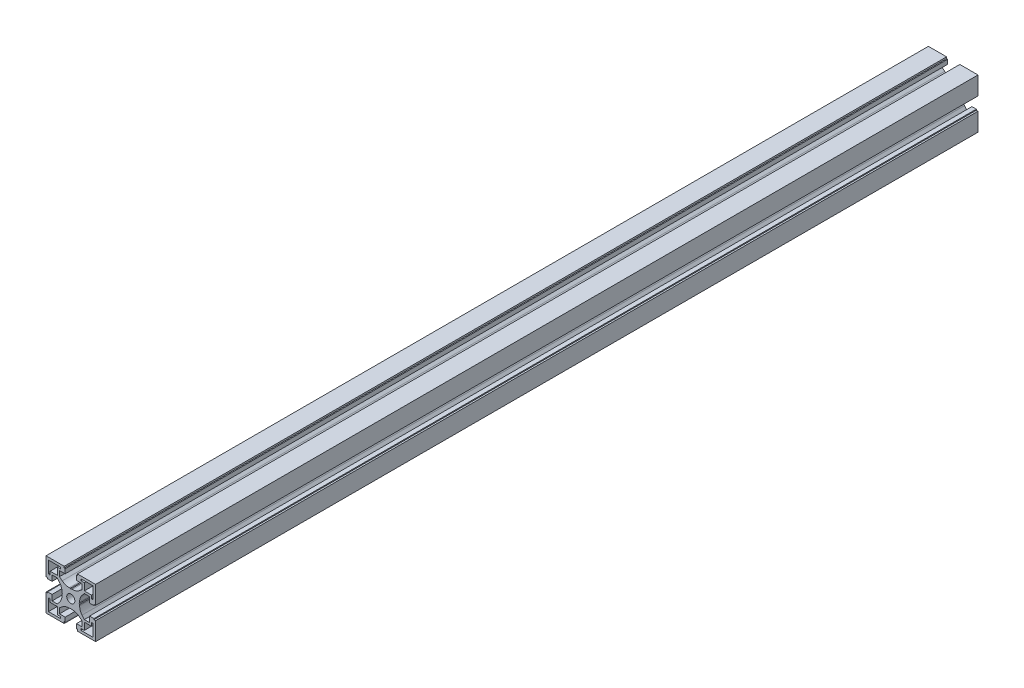
from build123d import *

# Parameters (mm, degrees)
MODEL_R             = 3.7
BOSS_EXTRUDE1_DEPTH = 800.5


with BuildPart() as part:
    # Model → Boss-Extrude1 (new body)
    with BuildSketch(Plane.XY):
        with BuildLine():
            Line((0.5, 8), (1.472732261, 8))
            ThreePointArc((1.472732261, 8), (4.799135414, 8.56946226), (7.746686356, 10.212991588))
            Line((7.746686356, 10.212991588), (10.25, 12.229898987))
            Line((10.25, 12.229898987), (10.25, 17))
            Line((10.25, 17), (5.1, 17))
            Line((5.1, 17), (5.1, 21))
            Line((5.1, 21), (5.999986755, 21))
            Line((5.999986755, 21), (5.999986755, 22.5))
            Line((5.999986755, 22.5), (22.5, 22.5))
            Line((22.5, 22.5), (22.5, 5.999986755))
            Line((22.5, 5.999986755), (21, 5.999986755))
            Line((21, 5.999986755), (21, 5.1))
            Line((21, 5.1), (17, 5.1))
            Line((17, 5.1), (17, 10.25))
            Line((17, 10.25), (12.229898987, 10.25))
            Line((12.229898987, 10.25), (10.212991588, 7.746686356))
            ThreePointArc((10.212991588, 7.746686356), (8.56946226, 4.799135414), (8, 1.472732261))
            Line((8, 1.472732261), (8, 0.5))
            Line((8, 0.5), (7.5, 0))
            Line((7.5, 0), (8, -0.5))
            Line((8, -0.5), (8, -1.472732261))
            ThreePointArc((8, -1.472732261), (8.56946226, -4.799135414), (10.212991588, -7.746686356))
            Line((10.212991588, -7.746686356), (12.229898987, -10.25))
            Line((12.229898987, -10.25), (17, -10.25))
            Line((17, -10.25), (17, -5.1))
            Line((17, -5.1), (21, -5.1))
            Line((21, -5.1), (21, -6.000013245))
            Line((21, -6.000013245), (22.5, -6.000013245))
            Line((22.5, -6.000013245), (22.5, -22.5))
            Line((22.5, -22.5), (6.000013245, -22.5))
            Line((6.000013245, -22.5), (6.000013245, -21))
            Line((6.000013245, -21), (5.1, -21))
            Line((5.1, -21), (5.1, -17))
            Line((5.1, -17), (10.25, -17))
            Line((10.25, -17), (10.25, -12.229898987))
            Line((10.25, -12.229898987), (7.746686356, -10.212991588))
            ThreePointArc((7.746686356, -10.212991588), (4.799135414, -8.56946226), (1.472732261, -8))
            Line((1.472732261, -8), (0.5, -8))
            Line((0.5, -8), (0, -7.5))
            Line((0, -7.5), (-0.5, -8))
            Line((-0.5, -8), (-1.472732261, -8))
            ThreePointArc((-1.472732261, -8), (-4.799135414, -8.56946226), (-7.746686356, -10.212991588))
            Line((-7.746686356, -10.212991588), (-10.25, -12.229898987))
            Line((-10.25, -12.229898987), (-10.25, -17))
            Line((-10.25, -17), (-5.1, -17))
            Line((-5.1, -17), (-5.1, -21))
            Line((-5.1, -21), (-5.999986755, -21))
            Line((-5.999986755, -21), (-5.999986755, -22.5))
            Line((-5.999986755, -22.5), (-22.5, -22.5))
            Line((-22.5, -22.5), (-22.5, -5.999986755))
            Line((-22.5, -5.999986755), (-21, -5.999986755))
            Line((-21, -5.999986755), (-21, -5.1))
            Line((-21, -5.1), (-17, -5.1))
            Line((-17, -5.1), (-17, -10.25))
            Line((-17, -10.25), (-12.229898987, -10.25))
            Line((-12.229898987, -10.25), (-10.212991588, -7.746686356))
            ThreePointArc((-10.212991588, -7.746686356), (-8.56946226, -4.799135414), (-8, -1.472732261))
            Line((-8, -1.472732261), (-8, -0.5))
            Line((-8, -0.5), (-7.5, 0))
            Line((-7.5, 0), (-8, 0.5))
            Line((-8, 0.5), (-8, 1.472732261))
            ThreePointArc((-8, 1.472732261), (-8.56946226, 4.799135414), (-10.212991588, 7.746686356))
            Line((-10.212991588, 7.746686356), (-12.229898987, 10.25))
            Line((-12.229898987, 10.25), (-17, 10.25))
            Line((-17, 10.25), (-17, 5.1))
            Line((-17, 5.1), (-21, 5.1))
            Line((-21, 5.1), (-21, 6.000013245))
            Line((-21, 6.000013245), (-22.5, 6.000013245))
            Line((-22.5, 6.000013245), (-22.5, 22.5))
            Line((-22.5, 22.5), (-6.000013245, 22.5))
            Line((-6.000013245, 22.5), (-6.000013245, 21))
            Line((-6.000013245, 21), (-5.1, 21))
            Line((-5.1, 21), (-5.1, 17))
            Line((-5.1, 17), (-10.25, 17))
            Line((-10.25, 17), (-10.25, 12.229898987))
            Line((-10.25, 12.229898987), (-7.746686356, 10.212991588))
            ThreePointArc((-7.746686356, 10.212991588), (-4.799135414, 8.56946226), (-1.472732261, 8))
            Line((-1.472732261, 8), (-0.5, 8))
            Line((-0.5, 8), (0, 7.5))
            Line((0, 7.5), (0.5, 8))
        make_face()
        Circle(MODEL_R, mode=Mode.SUBTRACT)
        Polygon((20.25, -9.25), (20.25, -20.25), (9.25, -20.25), (9.25, -18.75), (12.25, -18.75), (12.25, -12.25), (18.75, -12.25), (18.75, -9.25), align=None, mode=Mode.SUBTRACT)
        Polygon((9.25, 20.25), (20.25, 20.25), (20.25, 9.25), (18.75, 9.25), (18.75, 12.25), (12.25, 12.25), (12.25, 18.75), (9.25, 18.75), align=None, mode=Mode.SUBTRACT)
        Polygon((-9.25, -20.25), (-20.25, -20.25), (-20.25, -9.25), (-18.75, -9.25), (-18.75, -12.25), (-12.25, -12.25), (-12.25, -18.75), (-9.25, -18.75), align=None, mode=Mode.SUBTRACT)
        Polygon((-20.25, 20.25), (-9.25, 20.25), (-9.25, 18.75), (-12.25, 18.75), (-12.25, 12.25), (-18.75, 12.25), (-18.75, 9.25), (-20.25, 9.25), align=None, mode=Mode.SUBTRACT)
    extrude(amount=-BOSS_EXTRUDE1_DEPTH)


solid = part.part
